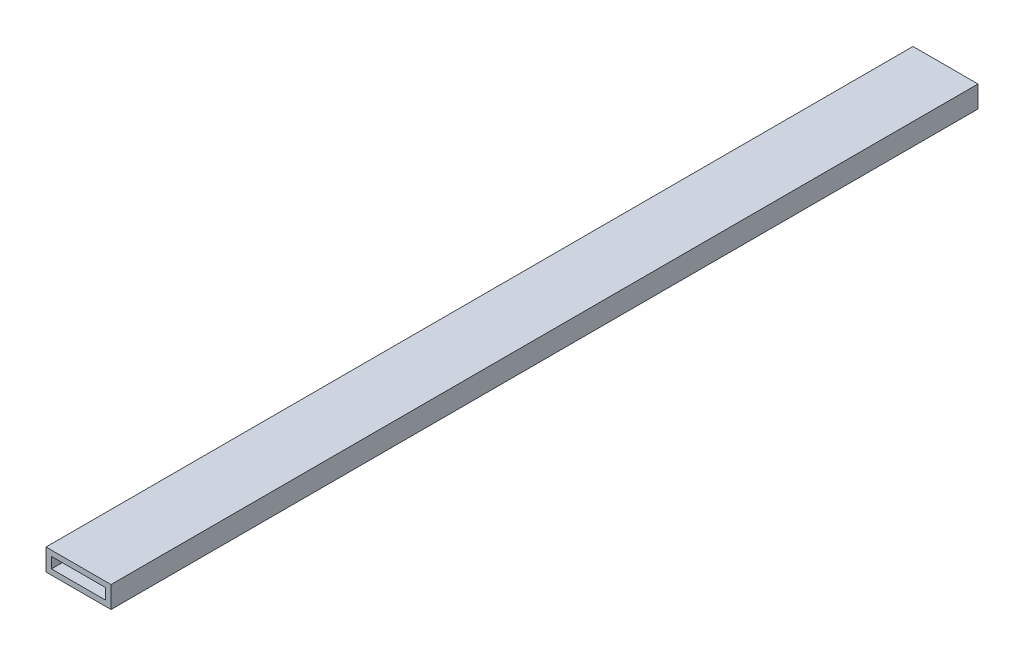
from build123d import *

# Parameters (mm, degrees)
SKETCH1_W           = 30
SKETCH1_H           = 10
SKETCH1_W_2         = 25
SKETCH1_H_2         = 5
BOSS_EXTRUDE1_DEPTH = 200


with BuildPart() as part:
    # Sketch1 → Boss-Extrude1 (new, symmetric)
    with BuildSketch(Plane.XY):
        Rectangle(SKETCH1_W, SKETCH1_H)
        Rectangle(SKETCH1_W_2, SKETCH1_H_2, mode=Mode.SUBTRACT)
    extrude(amount=BOSS_EXTRUDE1_DEPTH, both=True)


solid = part.part
